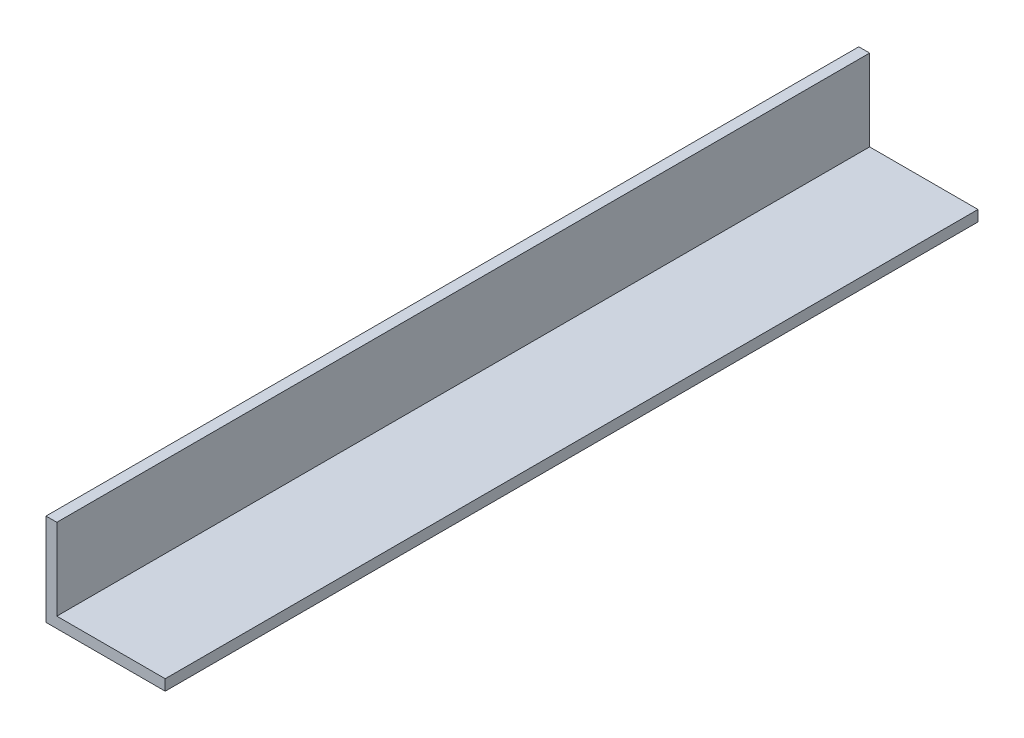
from build123d import *

# Parameters (mm, degrees)
BOSS_EXTRUDE1_DEPTH = 150


with BuildPart() as part:
    # Sketch1 → Boss-Extrude1 (new body)
    with BuildSketch(Plane.XY):
        Polygon((0, 0), (0, 17), (2, 17), (2, 2), (22, 2), (22, 0), align=None)
    extrude(amount=BOSS_EXTRUDE1_DEPTH)


solid = part.part
